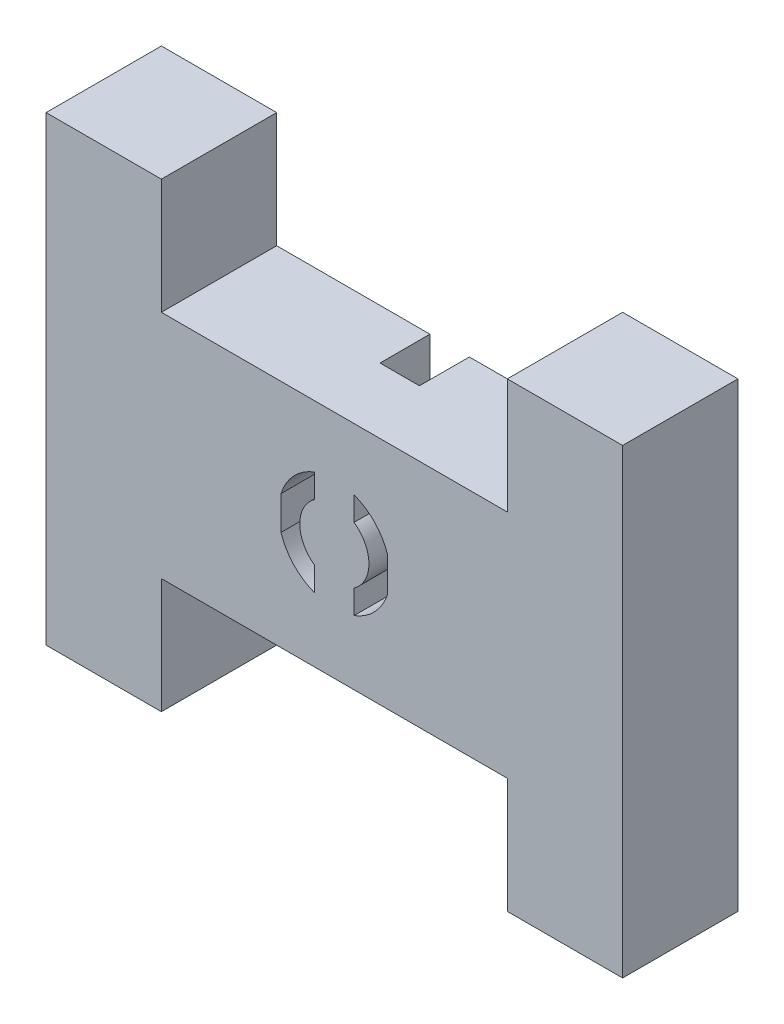
from build123d import *

# Parameters (mm, degrees)
SKETCH_1_W               = 200
SKETCH_1_H               = 200
EXTRUDE_1_DEPTH          = 100
CUT_EXTRUDE_1_DEPTH      = 301
CUT_EXTRUDE_1_DEPTH_BACK = 34.3
SKETCH_3_R               = 30
CUT_EXTRUDE_2_DEPTH      = 9
CUT_EXTRUDE_3_REACH      = 302
CUT_EXTRUDE_4_DEPTH      = 55
SKETCH_7_R               = 1.75
CUT_EXTRUDE_7_DEPTH      = 291.373018719
SKETCH_9_W               = 100
SKETCH_9_H               = 200
EXTRUDE_2_DEPTH          = 150
SKETCH_10_W              = 100
SKETCH_10_H              = 200
EXTRUDE_3_DEPTH          = 150
SKETCH_11_W              = 100
SKETCH_11_H              = 100
EXTRUDE_4_DEPTH          = 100
SKETCH_12_W              = 100
SKETCH_12_H              = 100
EXTRUDE_5_DEPTH          = 100


with BuildPart() as part:
    # 草图1 → 凸台-拉伸1 (new body)
    with BuildSketch(Plane.XY):
        with Locations((100, -100)):
            Rectangle(SKETCH_1_W, SKETCH_1_H)
    extrude(amount=EXTRUDE_1_DEPTH)

    # 草图2 → 切除-拉伸1 (cut, two sides: drawn at the far end of the back side and taken through both)
    with BuildSketch(Plane(origin=(0, 0, 0), x_dir=(-1, 0, 0), z_dir=(0, 0, -1)).offset(-CUT_EXTRUDE_1_DEPTH_BACK)):
        with BuildLine():
            Line((-146.25, -84.273215621), (-146.25, -98.874157372))
            Line((-146.25, -98.874157372), (-146.25, -113.475099122))
            ThreePointArc((-146.25, -113.475099122), (-100, -147.374157372), (-53.75, -113.475099122))
            Line((-53.75, -113.475099122), (-53.75, -84.273215621))
            ThreePointArc((-53.75, -84.273215621), (-100, -50.374157372), (-146.25, -84.273215621))
        make_face()
    extrude(amount=CUT_EXTRUDE_1_DEPTH + CUT_EXTRUDE_1_DEPTH_BACK, mode=Mode.SUBTRACT)

    # 草图3 → 切除-拉伸2 (cut)
    with BuildSketch(Plane(origin=(0, 0, 34.3), x_dir=(-1, 0, 0), z_dir=(0, 0, -1))):
        with Locations((-100, -98.874157372)):
            Circle(SKETCH_3_R)
    extrude(amount=-CUT_EXTRUDE_2_DEPTH, mode=Mode.SUBTRACT)

    # 切除-拉伸3: up to this face of the body (flat: up to its plane)
    cut_extrude_3_end = Plane(part.part.faces().sort_by_distance((100, -98.874157372, 43.3))[0])
    # 草图4 → 切除-拉伸3 (cut, up to the picked face)
    with BuildSketch(Plane(origin=(0, 0, 0), x_dir=(-1, 0, 0), z_dir=(0, 0, -1)), mode=Mode.PRIVATE) as cut_extrude_3_sk1:
        with BuildLine():
            Line((-82.891665128, 0), (-117.108334872, 0))
            Line((-117.108334872, 0), (-117.108334872, -53.491838371))
            ThreePointArc((-117.108334872, -53.491838371), (-100, -50.374157372), (-82.891665128, -53.491838371))
            Line((-82.891665128, -53.491838371), (-82.891665128, 0))
        make_face()
    cut_extrude_3_tool1 = split(extrude(cut_extrude_3_sk1.sketch, amount=-CUT_EXTRUDE_3_REACH, mode=Mode.PRIVATE), bisect_by=cut_extrude_3_end, keep=Keep.BOTH, mode=Mode.PRIVATE)
    # 草图4 → 切除-拉伸3 (cut, up to the picked face)
    with BuildSketch(Plane(origin=(0, 0, 0), x_dir=(-1, 0, 0), z_dir=(0, 0, -1)), mode=Mode.PRIVATE) as cut_extrude_3_sk2:
        with BuildLine():
            ThreePointArc((-82.891665128, -53.491838371), (-100, -50.374157372), (-117.108334872, -53.491838371))
            Line((-117.108334872, -53.491838371), (-117.108334872, -74.230600853))
            ThreePointArc((-117.108334872, -74.230600853), (-100, -68.874157372), (-82.891665128, -74.230600853))
            Line((-82.891665128, -74.230600853), (-82.891665128, -53.491838371))
        make_face()
    cut_extrude_3_tool2 = split(extrude(cut_extrude_3_sk2.sketch, amount=-CUT_EXTRUDE_3_REACH, mode=Mode.PRIVATE), bisect_by=cut_extrude_3_end, keep=Keep.BOTH, mode=Mode.PRIVATE)
    # 草图4 → 切除-拉伸3 (cut, up to the picked face)
    with BuildSketch(Plane(origin=(0, 0, 0), x_dir=(-1, 0, 0), z_dir=(0, 0, -1)), mode=Mode.PRIVATE) as cut_extrude_3_sk3:
        with BuildLine():
            ThreePointArc((-82.891665128, -74.230600853), (-100, -68.874157372), (-117.108334872, -74.230600853))
            Line((-117.108334872, -74.230600853), (-117.108334872, -123.517713891))
            ThreePointArc((-117.108334872, -123.517713891), (-100, -128.874157372), (-82.891665128, -123.517713891))
            Line((-82.891665128, -123.517713891), (-82.891665128, -74.230600853))
        make_face()
    cut_extrude_3_tool3 = split(extrude(cut_extrude_3_sk3.sketch, amount=-CUT_EXTRUDE_3_REACH, mode=Mode.PRIVATE), bisect_by=cut_extrude_3_end, keep=Keep.BOTH, mode=Mode.PRIVATE)
    # 草图4 → 切除-拉伸3 (cut, up to the picked face)
    with BuildSketch(Plane(origin=(0, 0, 0), x_dir=(-1, 0, 0), z_dir=(0, 0, -1)), mode=Mode.PRIVATE) as cut_extrude_3_sk4:
        with BuildLine():
            ThreePointArc((-82.891665128, -123.517713891), (-100, -128.874157372), (-117.108334872, -123.517713891))
            Line((-117.108334872, -123.517713891), (-117.108334872, -144.256476373))
            ThreePointArc((-117.108334872, -144.256476373), (-100, -147.374157372), (-82.891665128, -144.256476373))
            Line((-82.891665128, -144.256476373), (-82.891665128, -123.517713891))
        make_face()
    cut_extrude_3_tool4 = split(extrude(cut_extrude_3_sk4.sketch, amount=-CUT_EXTRUDE_3_REACH, mode=Mode.PRIVATE), bisect_by=cut_extrude_3_end, keep=Keep.BOTH, mode=Mode.PRIVATE)
    # 草图4 → 切除-拉伸3 (cut, up to the picked face)
    with BuildSketch(Plane(origin=(0, 0, 0), x_dir=(-1, 0, 0), z_dir=(0, 0, -1)), mode=Mode.PRIVATE) as cut_extrude_3_sk5:
        with BuildLine():
            ThreePointArc((-82.891665128, -144.256476373), (-100, -147.374157372), (-117.108334872, -144.256476373))
            Line((-117.108334872, -144.256476373), (-117.108334872, -200))
            Line((-117.108334872, -200), (-82.891665128, -200))
            Line((-82.891665128, -200), (-82.891665128, -144.256476373))
        make_face()
    cut_extrude_3_tool5 = split(extrude(cut_extrude_3_sk5.sketch, amount=-CUT_EXTRUDE_3_REACH, mode=Mode.PRIVATE), bisect_by=cut_extrude_3_end, keep=Keep.BOTH, mode=Mode.PRIVATE)
    add(cut_extrude_3_tool1.solids().sort_by(Axis((100, -25.708145, 0), (0, 0, 1)))[0], mode=Mode.SUBTRACT)
    add(cut_extrude_3_tool2.solids().sort_by(Axis((100, -61.037282, 0), (0, 0, 1)))[0], mode=Mode.SUBTRACT)
    add(cut_extrude_3_tool3.solids().sort_by(Axis((100, -98.874157, 0), (0, 0, 1)))[0], mode=Mode.SUBTRACT)
    add(cut_extrude_3_tool4.solids().sort_by(Axis((100, -136.711033, 0), (0, 0, 1)))[0], mode=Mode.SUBTRACT)
    add(cut_extrude_3_tool5.solids().sort_by(Axis((100, -173.166361, 0), (0, 0, 1)))[0], mode=Mode.SUBTRACT)

    # 草图6 → 切除-拉伸4 (cut)
    with BuildSketch(Plane.XY.offset(100)):
        with BuildLine():
            Line((82.891665128, -74.230600853), (82.891665128, -53.491838371))
            ThreePointArc((82.891665128, -53.491838371), (64.780077431, -65.530386526), (53.75, -84.273215621))
            Line((53.75, -84.273215621), (53.75, -113.475099122))
            ThreePointArc((53.75, -113.475099122), (64.780077431, -132.217928217), (82.891665128, -144.256476373))
            Line((82.891665128, -144.256476373), (82.891665128, -123.517713891))
            ThreePointArc((82.891665128, -123.517713891), (70, -98.874157372), (82.891665128, -74.230600853))
        make_face()
        with BuildLine():
            Line((117.108334872, -53.491838371), (117.108334872, -74.230600853))
            ThreePointArc((117.108334872, -74.230600853), (130, -98.874157372), (117.108334872, -123.517713891))
            Line((117.108334872, -123.517713891), (117.108334872, -144.256476373))
            ThreePointArc((117.108334872, -144.256476373), (135.219922569, -132.217928217), (146.25, -113.475099122))
            Line((146.25, -113.475099122), (146.25, -84.273215621))
            ThreePointArc((146.25, -84.273215621), (135.219922569, -65.530386526), (117.108334872, -53.491838371))
        make_face()
    extrude(amount=-CUT_EXTRUDE_4_DEPTH, mode=Mode.SUBTRACT)

    # 草图7 → 切除-拉伸7 (cut, through all)
    with BuildSketch(Plane(origin=(0, 0, 34.3), x_dir=(-1, 0, 0), z_dir=(0, 0, -1))):
        with Locations((-142.5, -98.874157372)):
            Circle(SKETCH_7_R)
        with Locations((-130.0520382, -68.822119171)):
            Circle(SKETCH_7_R)
        with Locations((-69.9479618, -68.822119171)):
            Circle(SKETCH_7_R)
        with Locations((-57.5, -98.874157372)):
            Circle(SKETCH_7_R)
        with Locations((-69.9479618, -128.926195572)):
            Circle(SKETCH_7_R)
        with Locations((-130.0520382, -128.926195572)):
            Circle(SKETCH_7_R)
    extrude(amount=-CUT_EXTRUDE_7_DEPTH, mode=Mode.SUBTRACT)

    # 草图9 → 凸台-拉伸2 (add)
    with BuildSketch(Plane.ZY):
        with Locations((50, -100)):
            Rectangle(SKETCH_9_W, SKETCH_9_H)
    extrude(amount=EXTRUDE_2_DEPTH)

    # 草图10 → 凸台-拉伸3 (add)
    with BuildSketch(Plane(origin=(200, 0, 0), x_dir=(0, 0, -1), z_dir=(1, 0, 0))):
        with Locations((-50, -100)):
            Rectangle(SKETCH_10_W, SKETCH_10_H)
    extrude(amount=EXTRUDE_3_DEPTH)

    # 草图11 → 凸台-拉伸4 (add)
    with BuildSketch(Plane.XZ.offset(200)):
        with Locations((-100, 50)):
            Rectangle(SKETCH_11_W, SKETCH_11_H)
        with Locations((300, 50)):
            Rectangle(SKETCH_11_W, SKETCH_11_H)
    extrude(amount=EXTRUDE_4_DEPTH)

    # 草图12 → 凸台-拉伸5 (add)
    with BuildSketch(Plane(origin=(0, 0, 0), x_dir=(1, 0, 0), z_dir=(0, 1, 0))):
        with Locations((300, -50)):
            Rectangle(SKETCH_12_W, SKETCH_12_H)
        with Locations((-100, -50)):
            Rectangle(SKETCH_12_W, SKETCH_12_H)
    extrude(amount=EXTRUDE_5_DEPTH)


solid = part.part
